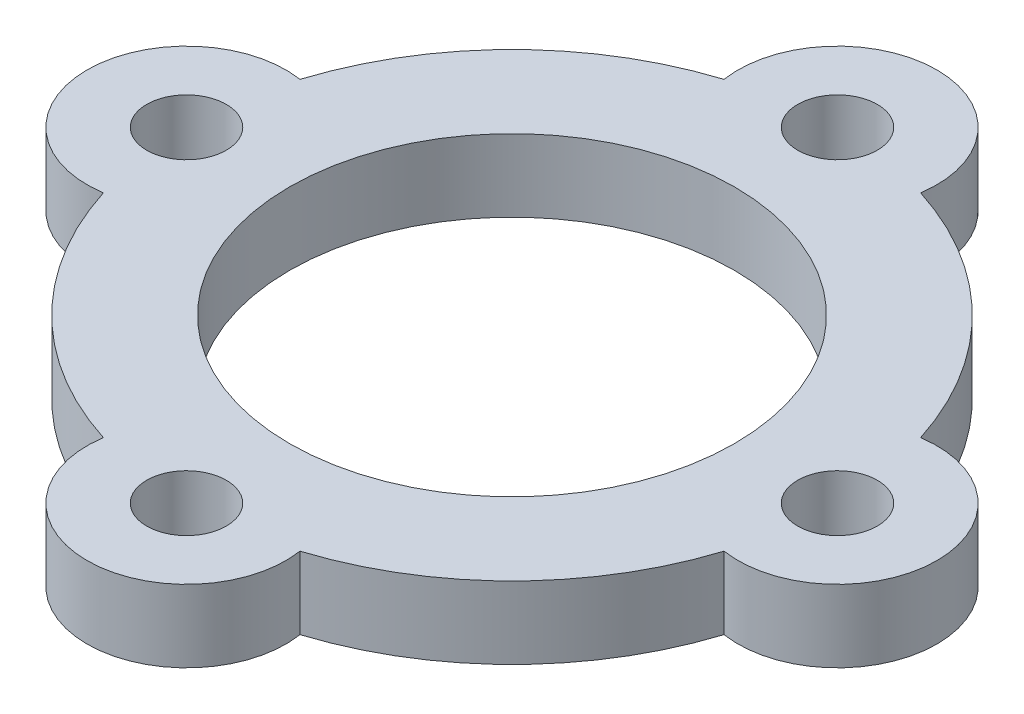
from build123d import *

# Parameters (mm, degrees)
SKETCH1_R           = 1.1
SKETCH1_R_2         = 6.15
BOSS_EXTRUDE1_DEPTH = 2


with BuildPart() as part:
    # Sketch1 → Boss-Extrude1 (new body)
    with BuildSketch(Plane(origin=(0, 0, 0), x_dir=(1, 0, 0), z_dir=(0, 1, 0))):
        with BuildLine():
            ThreePointArc((-2.717716562, -8.579861111), (0, -11.75), (2.717716562, -8.579861111))
            ThreePointArc((2.717716562, -8.579861111), (6.363961031, -6.363961031), (8.579861111, -2.717716562))
            ThreePointArc((8.579861111, -2.717716562), (11.75, 0), (8.579861111, 2.717716562))
            ThreePointArc((8.579861111, 2.717716562), (6.363961031, 6.363961031), (2.717716562, 8.579861111))
            ThreePointArc((2.717716562, 8.579861111), (0, 11.75), (-2.717716562, 8.579861111))
            ThreePointArc((-2.717716562, 8.579861111), (-6.363961031, 6.363961031), (-8.579861111, 2.717716562))
            ThreePointArc((-8.579861111, 2.717716562), (-11.75, 0), (-8.579861111, -2.717716562))
            ThreePointArc((-8.579861111, -2.717716562), (-6.363961031, -6.363961031), (-2.717716562, -8.579861111))
        make_face()
        with Locations(Location((0, -9, 0), (0, 0, 270))):
            Circle(SKETCH1_R, mode=Mode.SUBTRACT)
        with Locations(Location((-9, 0, 0), (0, 0, 270))):
            Circle(SKETCH1_R, mode=Mode.SUBTRACT)
        with Locations(Location((0, 0, 0), (0, 0, 270))):
            Circle(SKETCH1_R_2, mode=Mode.SUBTRACT)
        with Locations(Location((9, 0, 0), (0, 0, 270))):
            Circle(SKETCH1_R, mode=Mode.SUBTRACT)
        with Locations(Location((0, 9, 0), (0, 0, 270))):
            Circle(SKETCH1_R, mode=Mode.SUBTRACT)
    extrude(amount=BOSS_EXTRUDE1_DEPTH)


solid = part.part
